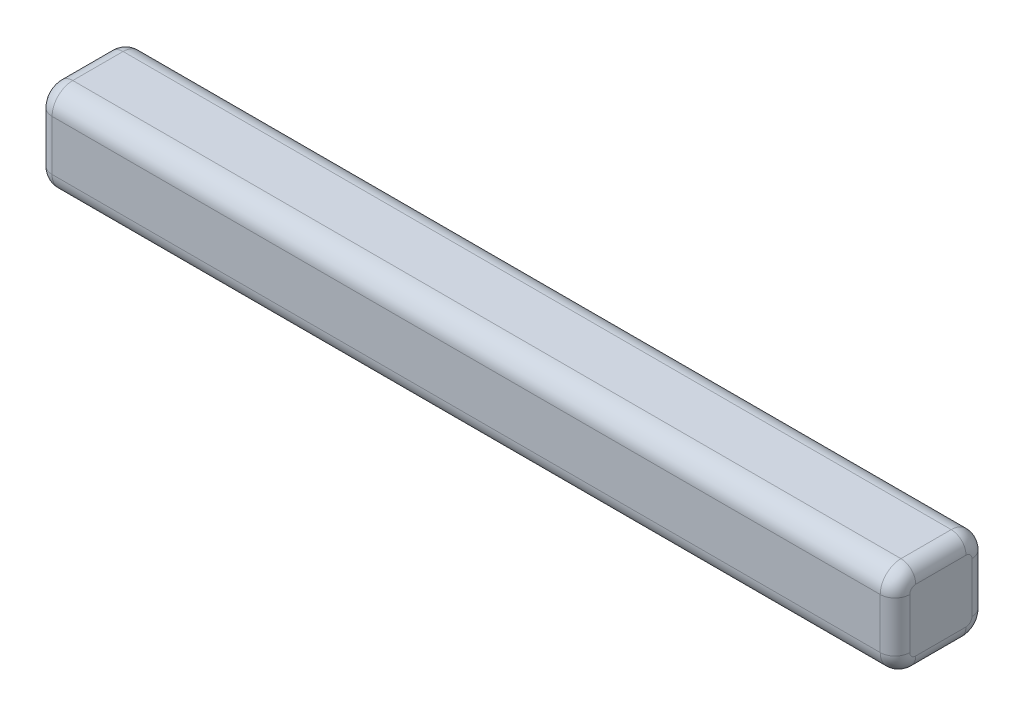
from build123d import *

# Parameters (mm, degrees)
BOSS_EXTRUDE1_START = 11.440071
SKETCH2_W           = 3.1
SKETCH2_H           = 3.1
BOSS_EXTRUDE1_DEPTH = 29
FILLET1_R           = 0.7
FILLET3_R           = 0.5


with BuildPart() as part:
    # Sketch2 → Boss-Extrude1 (new body)
    with BuildSketch(Plane(origin=(0, 0, 0), x_dir=(0, 0, -1), z_dir=(1, 0, 0)).offset(BOSS_EXTRUDE1_START)):
        with Locations((-38.793556796, 142.574028513)):
            Rectangle(SKETCH2_W, SKETCH2_H)
    extrude(amount=BOSS_EXTRUDE1_DEPTH)

    # Fillet1
    fillet1_edges = [part.edges().sort_by_distance(p)[0] for p in [
        (25.940071, 144.124028513, 40.343556796),
        (25.940071, 144.124028513, 37.243556796),
        (25.940071, 141.024028513, 37.243556796),
        (25.940071, 141.024028513, 40.343556796),
    ]]
    fillet(fillet1_edges, radius=FILLET1_R)

    # Fillet3
    fillet3_edges = [part.edges().sort_by_distance(p)[0] for p in [
        (40.440071, 144.124028513, 38.793556796),
        (11.440071, 144.124028513, 38.793556796),
        (11.440071, 142.574028513, 40.343556796),
        (11.440071, 142.574028513, 37.243556796),
        (11.440071, 141.024028513, 38.793556796),
        (11.440071, 141.229053766, 40.138531543),
        (11.440071, 141.229053766, 37.44858205),
        (11.440071, 143.91900326, 40.138531543),
        (11.440071, 143.91900326, 37.44858205),
        (40.440071, 142.574028513, 37.243556796),
        (40.440071, 141.024028513, 38.793556796),
        (40.440071, 142.574028513, 40.343556796),
        (40.440071, 141.229053766, 40.138531543),
        (40.440071, 141.229053766, 37.44858205),
        (40.440071, 143.91900326, 40.138531543),
        (40.440071, 143.91900326, 37.44858205),
    ]]
    fillet(fillet3_edges, radius=FILLET3_R)


solid = part.part
